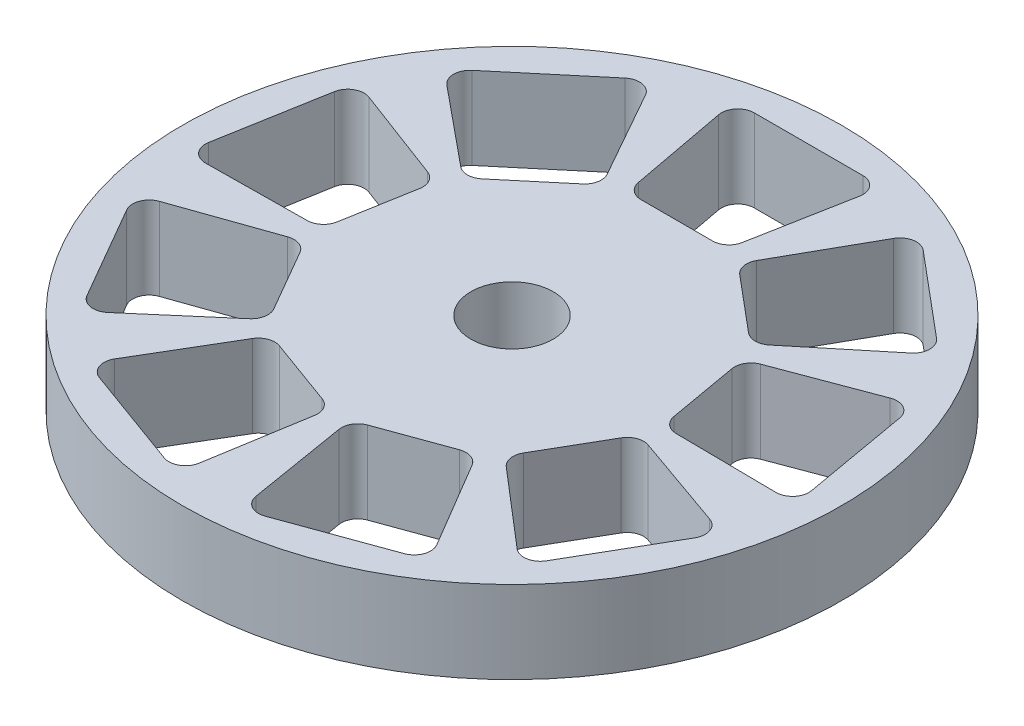
from build123d import *

# Parameters (mm, degrees)
SKETCH1_R           = 101.6
BOSS_EXTRUDE1_DEPTH = 25.4
CUT_EXTRUDE1_DEPTH  = 25.4
SKETCH3_R           = 12.7
CUT_EXTRUDE2_DEPTH  = 25.4


with BuildPart() as part:
    # Sketch1 → Boss-Extrude1 (new body)
    with BuildSketch(Plane(origin=(0, 0, 0), x_dir=(1, 0, 0), z_dir=(0, 1, 0))):
        with Locations(Location((0, 0, 0), (0, 0, 270))):
            Circle(SKETCH1_R)
    extrude(amount=BOSS_EXTRUDE1_DEPTH)

    # Sketch2 → Cut-Extrude1 (cut)
    with BuildSketch(Plane(origin=(0, 25.4, 0), x_dir=(1, 0, 0), z_dir=(0, 1, 0))):
        with BuildLine():
            Line((0, 91.44), (16.738974461, 91.44))
            ThreePointArc((16.738974461, 91.44), (20.64808073, 89.604270053), (21.73196517, 85.423814242))
            Line((21.73196517, 85.423814242), (16.01696517, 54.943814242))
            ThreePointArc((16.01696517, 54.943814242), (14.268244513, 51.970893731), (11.023974461, 50.8))
            Line((11.023974461, 50.8), (0, 50.8))
            Line((0, 50.8), (-11.023974461, 50.8))
            ThreePointArc((-11.023974461, 50.8), (-14.268244513, 51.970893731), (-16.01696517, 54.943814242))
            Line((-16.01696517, 54.943814242), (-21.73196517, 85.423814242))
            ThreePointArc((-21.73196517, 85.423814242), (-20.64808073, 89.604270053), (-16.738974461, 91.44))
            Line((-16.738974461, 91.44), (0, 91.44))
        make_face()
        with BuildLine():
            Line((38.26171821, 79.407476156), (23.047495859, 52.38491034))
            ThreePointArc((23.047495859, 52.38491034), (22.476137132, 48.983465131), (24.208756195, 46.001131903))
            Line((24.208756195, 46.001131903), (32.653610572, 38.91505771))
            Line((32.653610572, 38.91505771), (41.098464949, 31.828983518))
            ThreePointArc((41.098464949, 31.828983518), (44.336355977, 30.640563561), (47.586910188, 31.793896828))
            Line((47.586910188, 31.793896828), (71.557020524, 51.469400264))
            ThreePointArc((71.557020524, 51.469400264), (73.413862069, 55.368522696), (71.599297399, 59.287498497))
            Line((71.599297399, 59.287498497), (58.77649903, 70.047103879))
            Line((58.77649903, 70.047103879), (45.953700661, 80.806709261))
            ThreePointArc((45.953700661, 80.806709261), (41.77916706, 81.913183611), (38.26171821, 79.407476156))
        make_face()
        with BuildLine():
            Line((80.352318408, 36.23549746), (51.327777432, 25.314524697))
            ThreePointArc((51.327777432, 25.314524697), (48.703684419, 23.076128807), (48.113940777, 19.677822943))
            Line((48.113940777, 19.677822943), (50.028233853, 8.821327425))
            Line((50.028233853, 8.821327425), (51.942526929, -2.035168092))
            ThreePointArc((51.942526929, -2.035168092), (53.658993735, -5.026826831), (56.890411059, -6.232738262))
            Line((56.890411059, -6.232738262), (87.899750706, -6.568118115))
            ThreePointArc((87.899750706, -6.568118115), (91.828481442, -4.774771782), (92.957513347, -0.606282461))
            Line((92.957513347, -0.606282461), (90.050820935, 15.878389366))
            Line((90.050820935, 15.878389366), (87.144128524, 32.363061192))
            ThreePointArc((87.144128524, 32.363061192), (84.65747826, 35.894008194), (80.352318408, 36.23549746))
        make_face()
        with BuildLine():
            Line((84.845175807, -23.891473209), (55.5912215, -13.600808392))
            ThreePointArc((55.5912215, -13.600808392), (52.142236485, -13.628784649), (49.506077743, -15.852958066))
            Line((49.506077743, -15.852958066), (43.994090512, -25.4))
            Line((43.994090512, -25.4), (38.482103282, -34.947041934))
            ThreePointArc((38.482103282, -34.947041934), (37.873991971, -38.342109081), (39.574256329, -41.34300585))
            Line((39.574256329, -41.34300585), (63.113210637, -61.532341033))
            ThreePointArc((63.113210637, -61.532341033), (67.275533788, -62.683897478), (70.819875692, -60.216377116))
            Line((70.819875692, -60.216377116), (79.189362922, -45.72))
            Line((79.189362922, -45.72), (87.558850152, -31.223622884))
            ThreePointArc((87.558850152, -31.223622884), (87.923614518, -26.920372575), (84.845175807, -23.891473209))
        make_face()
        with BuildLine():
            Line((49.638032496, -72.83935804), (33.8429152, -46.152172078))
            ThreePointArc((33.8429152, -46.152172078), (31.182856603, -43.956638301), (27.733770733, -43.965963811))
            Line((27.733770733, -43.965963811), (17.374623281, -47.736385136))
            Line((17.374623281, -47.736385136), (7.015475828, -51.506806461))
            ThreePointArc((7.015475828, -51.506806461), (4.367328442, -53.716692368), (3.740867244, -57.108421524))
            Line((3.740867244, -57.108421524), (8.795297885, -87.704897725))
            ThreePointArc((8.795297885, -87.704897725), (11.24361619, -91.26253089), (15.544831125, -91.650559689))
            Line((15.544831125, -91.650559689), (31.274321906, -85.925493245))
            Line((31.274321906, -85.925493245), (47.003812686, -80.2004268))
            ThreePointArc((47.003812686, -80.2004268), (50.049314382, -77.138411829), (49.638032496, -72.83935804))
        make_face()
        with BuildLine():
            Line((-8.795297885, -87.704897725), (-3.740867244, -57.108421524))
            ThreePointArc((-3.740867244, -57.108421524), (-4.367328442, -53.716692368), (-7.015475828, -51.506806461))
            Line((-7.015475828, -51.506806461), (-17.374623281, -47.736385136))
            Line((-17.374623281, -47.736385136), (-27.733770733, -43.965963811))
            ThreePointArc((-27.733770733, -43.965963811), (-31.182856603, -43.956638301), (-33.8429152, -46.152172078))
            Line((-33.8429152, -46.152172078), (-49.638032496, -72.83935804))
            ThreePointArc((-49.638032496, -72.83935804), (-50.049314382, -77.138411829), (-47.003812686, -80.2004268))
            Line((-47.003812686, -80.2004268), (-31.274321906, -85.925493245))
            Line((-31.274321906, -85.925493245), (-15.544831125, -91.650559689))
            ThreePointArc((-15.544831125, -91.650559689), (-11.24361619, -91.26253089), (-8.795297885, -87.704897725))
        make_face()
        with BuildLine():
            Line((-63.113210637, -61.532341033), (-39.574256329, -41.34300585))
            ThreePointArc((-39.574256329, -41.34300585), (-37.873991971, -38.342109081), (-38.482103282, -34.947041934))
            Line((-38.482103282, -34.947041934), (-43.994090512, -25.4))
            Line((-43.994090512, -25.4), (-49.506077743, -15.852958066))
            ThreePointArc((-49.506077743, -15.852958066), (-52.142236485, -13.628784649), (-55.5912215, -13.600808392))
            Line((-55.5912215, -13.600808392), (-84.845175807, -23.891473209))
            ThreePointArc((-84.845175807, -23.891473209), (-87.923614518, -26.920372575), (-87.558850152, -31.223622884))
            Line((-87.558850152, -31.223622884), (-79.189362922, -45.72))
            Line((-79.189362922, -45.72), (-70.819875692, -60.216377116))
            ThreePointArc((-70.819875692, -60.216377116), (-67.275533788, -62.683897478), (-63.113210637, -61.532341033))
        make_face()
        with BuildLine():
            Line((-87.899750706, -6.568118115), (-56.890411059, -6.232738262))
            ThreePointArc((-56.890411059, -6.232738262), (-53.658993735, -5.026826831), (-51.942526929, -2.035168092))
            Line((-51.942526929, -2.035168092), (-50.028233853, 8.821327425))
            Line((-50.028233853, 8.821327425), (-48.113940777, 19.677822943))
            ThreePointArc((-48.113940777, 19.677822943), (-48.703684419, 23.076128807), (-51.327777432, 25.314524697))
            Line((-51.327777432, 25.314524697), (-80.352318408, 36.23549746))
            ThreePointArc((-80.352318408, 36.23549746), (-84.65747826, 35.894008194), (-87.144128524, 32.363061192))
            Line((-87.144128524, 32.363061192), (-90.050820935, 15.878389366))
            Line((-90.050820935, 15.878389366), (-92.957513347, -0.606282461))
            ThreePointArc((-92.957513347, -0.606282461), (-91.828481442, -4.774771782), (-87.899750706, -6.568118115))
        make_face()
        with BuildLine():
            Line((-71.557020524, 51.469400264), (-47.586910188, 31.793896828))
            ThreePointArc((-47.586910188, 31.793896828), (-44.336355977, 30.640563561), (-41.098464949, 31.828983518))
            Line((-41.098464949, 31.828983518), (-32.653610572, 38.91505771))
            Line((-32.653610572, 38.91505771), (-24.208756195, 46.001131903))
            ThreePointArc((-24.208756195, 46.001131903), (-22.476137132, 48.983465131), (-23.047495859, 52.38491034))
            Line((-23.047495859, 52.38491034), (-38.26171821, 79.407476156))
            ThreePointArc((-38.26171821, 79.407476156), (-41.77916706, 81.913183611), (-45.953700661, 80.806709261))
            Line((-45.953700661, 80.806709261), (-58.77649903, 70.047103879))
            Line((-58.77649903, 70.047103879), (-71.599297399, 59.287498497))
            ThreePointArc((-71.599297399, 59.287498497), (-73.413862069, 55.368522696), (-71.557020524, 51.469400264))
        make_face()
    extrude(amount=-CUT_EXTRUDE1_DEPTH, mode=Mode.SUBTRACT)

    # Sketch3 → Cut-Extrude2 (cut)
    with BuildSketch(Plane(origin=(0, 25.4, 0), x_dir=(1, 0, 0), z_dir=(0, 1, 0))):
        with Locations(Location((0, 0, 0), (0, 0, 270))):
            Circle(SKETCH3_R)
    extrude(amount=-CUT_EXTRUDE2_DEPTH, mode=Mode.SUBTRACT)


solid = part.part
